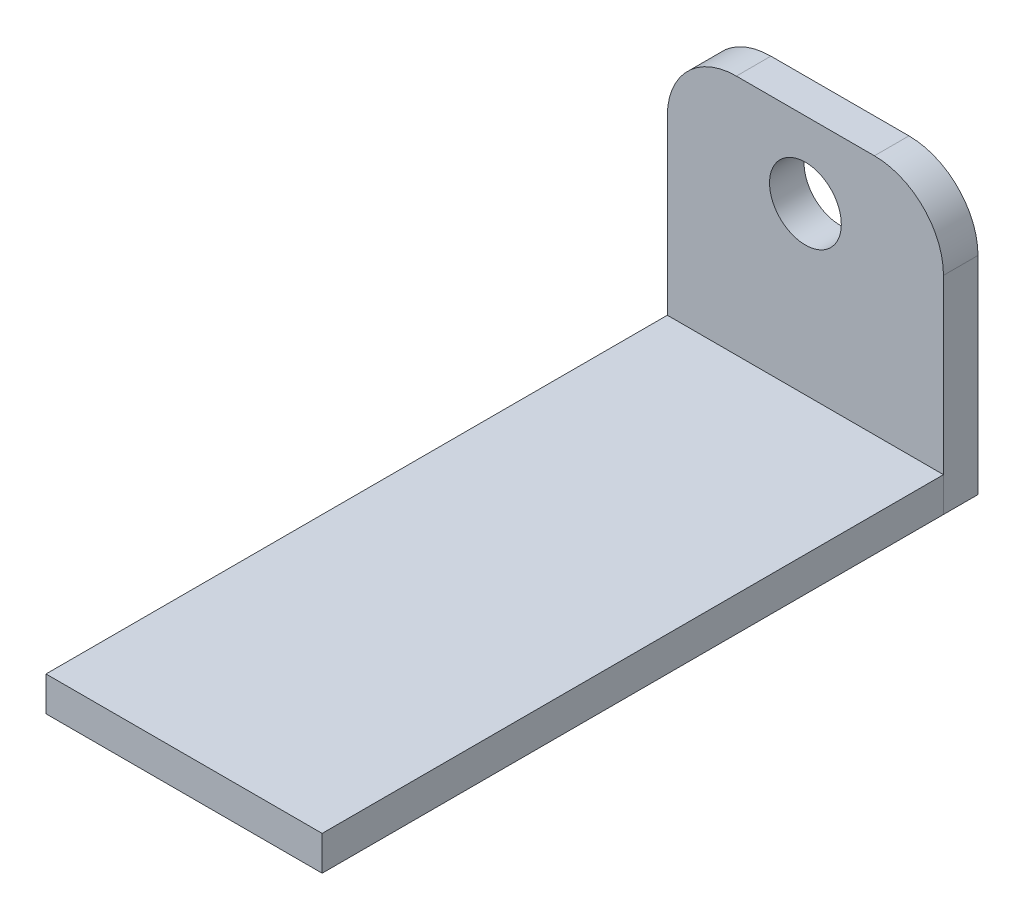
from build123d import *

# Parameters (mm, degrees)
SKETCH1_W           = 25.4
SKETCH1_H           = 57.15
SKETCH1_W_2         = 12.446
SKETCH1_H_2         = 3.175
BOSS_EXTRUDE1_DEPTH = 3.175
SKETCH2_W           = 6.35
SKETCH2_H           = 3.175
BOSS_EXTRUDE2_DEPTH = 3.175
SKETCH3_R           = 3.302
CUT_EXTRUDE1_DEPTH  = 68.501425911
FILLET1_R           = 6.35


with BuildPart() as part:
    # Sketch1 → Boss-Extrude1 (new body)
    with BuildSketch(Plane(origin=(0, 0, 0), x_dir=(1, 0, 0), z_dir=(0, 1, 0))):
        with Locations((12.7, 28.575)):
            Rectangle(SKETCH1_W, SKETCH1_H)
        with Locations((12.7, 58.7375)):
            Rectangle(SKETCH1_W_2, SKETCH1_H_2)
    extrude(amount=BOSS_EXTRUDE1_DEPTH)


with BuildPart() as body_2:
    # Sketch2 → Boss-Extrude2 (new body)
    with BuildSketch(Plane(origin=(0, 0, -57.15), x_dir=(-1, 0, 0), z_dir=(0, 0, -1))):
        Polygon((-25.4, 0), (-19.05, 0), (-19.05, 3.175), (-6.477, 3.175), (-6.35, 3.175), (0, 3.175), (0, 25.4), (-25.4, 25.4), align=None)
        with Locations((-3.175, 1.5875)):
            Rectangle(SKETCH2_W, SKETCH2_H)
    extrude(amount=BOSS_EXTRUDE2_DEPTH)

    # Sketch3 → Cut-Extrude1 (cut, through all)
    with BuildSketch(Plane.XY.offset(-57.15)):
        with Locations((12.7, 18.415)):
            Circle(SKETCH3_R)
    extrude(amount=-CUT_EXTRUDE1_DEPTH, mode=Mode.SUBTRACT)

    # Fillet1
    fillet1_edges = [body_2.edges().sort_by_distance(p)[0] for p in [
        (25.4, 25.4, -58.7375),
        (0, 25.4, -58.7375),
    ]]
    fillet(fillet1_edges, radius=FILLET1_R)


solid = Compound([part.part, body_2.part])
